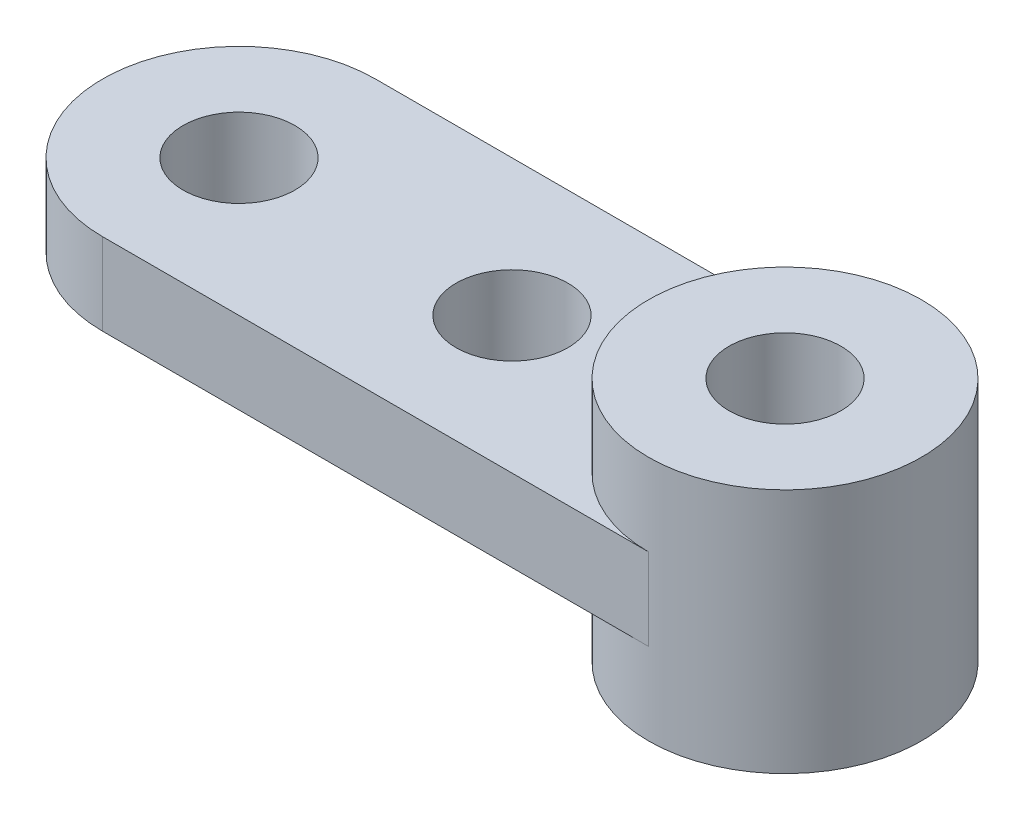
from build123d import *
from build123d.topology import SkipClean

# Parameters (mm, degrees)
SKETCH1_R           = 2.05
BOSS_EXTRUDE1_DEPTH = 1.5
SKETCH2_R           = 5
SKETCH2_R_2         = 2.05
BOSS_EXTRUDE2_DEPTH = 3


with BuildPart() as part:
    # Sketch1 → Boss-Extrude1 (new, symmetric)
    with BuildSketch(Plane(origin=(0, 0, 0), x_dir=(1, 0, 0), z_dir=(0, 1, 0))):
        with BuildLine():
            Line((-10, 0), (-5, 0))
            Line((-5, 0), (5, 0))
            Line((5, 0), (10, 0))
            ThreePointArc((10, 0), (15, -5), (10, -10))
            Line((10, -10), (5, -10))
            Line((5, -10), (-5, -10))
            Line((-5, -10), (-10, -10))
            ThreePointArc((-10, -10), (-15, -5), (-10, 0))
        make_face()
        with Locations(Location((10, -5, 0), (0, 0, 270))):
            Circle(SKETCH1_R, mode=Mode.SUBTRACT)
        with Locations(Location((-10, -5, 0), (0, 0, 90))):
            Circle(SKETCH1_R, mode=Mode.SUBTRACT)
        with Locations(Location((0, -5, 0), (0, 0, 270))):
            Circle(SKETCH1_R, mode=Mode.SUBTRACT)
    extrude(amount=BOSS_EXTRUDE1_DEPTH, both=True)

    # Sketch2 → Boss-Extrude2 (add)
    with BuildSketch(Plane(origin=(0, 1.5, 0), x_dir=(1, 0, 0), z_dir=(0, 1, 0))):
        with Locations(Location((10, -5, 0), (0, 0, 270))):
            Circle(SKETCH2_R)
        with Locations(Location((10, -5, 0), (0, 0, 270))):
            Circle(SKETCH2_R_2, mode=Mode.SUBTRACT)
    boss_extrude2 = extrude(amount=BOSS_EXTRUDE2_DEPTH)

    # Mirror1: Boss-Extrude2 across plane
    with SkipClean():  # the faces are left unmerged after this step: merging them gives an invalid solid
        add(boss_extrude2.mirror(Plane.ZX))


solid = part.part
